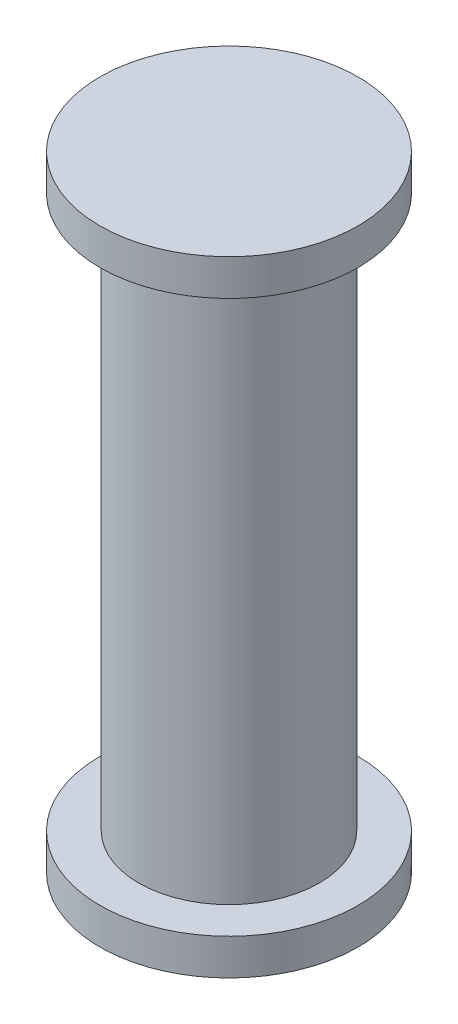
from build123d import *

# Parameters (mm, degrees)
SZKIC1_R                    = 1.75
DODANIE_WYCI_GNI_CIE1_DEPTH = 10.7
SZKIC2_R                    = 2.5
DODANIE_WYCI_GNI_CIE2_DEPTH = 0.7
DODANIE_WYCI_GNI_CIE3_START = 0.7
SZKIC3_R                    = 2.5
DODANIE_WYCI_GNI_CIE3_DEPTH = 0.7


with BuildPart() as part:
    # Szkic1 → Dodanie-wyciągnięcie1 (new body)
    with BuildSketch(Plane(origin=(0, 0, 0), x_dir=(1, 0, 0), z_dir=(0, 1, 0))):
        with Locations(Location((0, 0, 0), (0, 0, 270))):
            Circle(SZKIC1_R)
    extrude(amount=DODANIE_WYCI_GNI_CIE1_DEPTH)

    # Szkic2 → Dodanie-wyciągnięcie2 (add)
    with BuildSketch(Plane(origin=(0, 10.7, 0), x_dir=(1, 0, 0), z_dir=(0, 1, 0))):
        with Locations(Location((0, 0, 0), (0, 0, 270))):
            Circle(SZKIC2_R)
    extrude(amount=DODANIE_WYCI_GNI_CIE2_DEPTH)

    # Szkic3 → Dodanie-wyciągnięcie3 (add)
    with BuildSketch(Plane.XZ.offset(DODANIE_WYCI_GNI_CIE3_START)):
        with Locations(Location((0, 0, 0), (0, 0, 90))):
            Circle(SZKIC3_R)
    extrude(amount=-DODANIE_WYCI_GNI_CIE3_DEPTH)


solid = part.part
